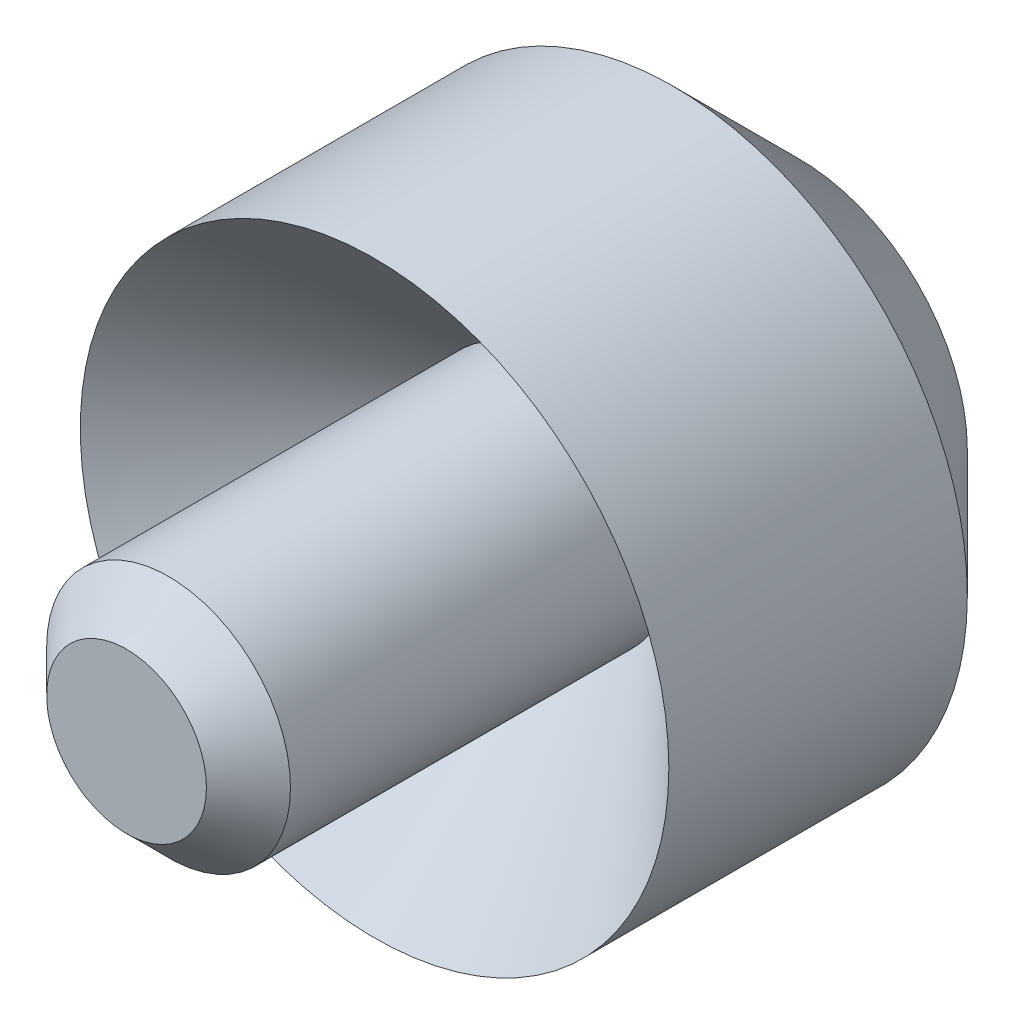
from build123d import *

# Parameters (mm, degrees)
SKETCH_1_R      = 1.45
EXTRUDE_1_DEPTH = 5
CHAMFER_1_SIZE  = 0.5


with BuildPart() as part:
    # 스케치1 → 보스-돌출1 (new body)
    with BuildSketch(Plane.XY):
        Circle(SKETCH_1_R)
    extrude(amount=EXTRUDE_1_DEPTH)

    # 스케치3 → 회전1 (revolve)
    with BuildSketch(Plane(origin=(0, 0, 0), x_dir=(0, 0, -1), z_dir=(1, 0, 0)), mode=Mode.PRIVATE) as revolve_1_sk:
        Polygon((0, 0), (3, 0), (3, -2), (1.5, -3.5), (-2.05, -3.5), (0, -1.45), align=None)
    revolve(revolve_1_sk.sketch.rotate(Axis((0, 0, 0), (0, 0, -1)), 270), axis=Axis((0, 0, 0), (0, 0, -1)))

    # 모따기1
    chamfer_1_edges = [part.edges().sort_by_distance(p)[0] for p in [
        (-1.45, 0, 5),
    ]]
    chamfer(chamfer_1_edges, length=CHAMFER_1_SIZE)


solid = part.part
